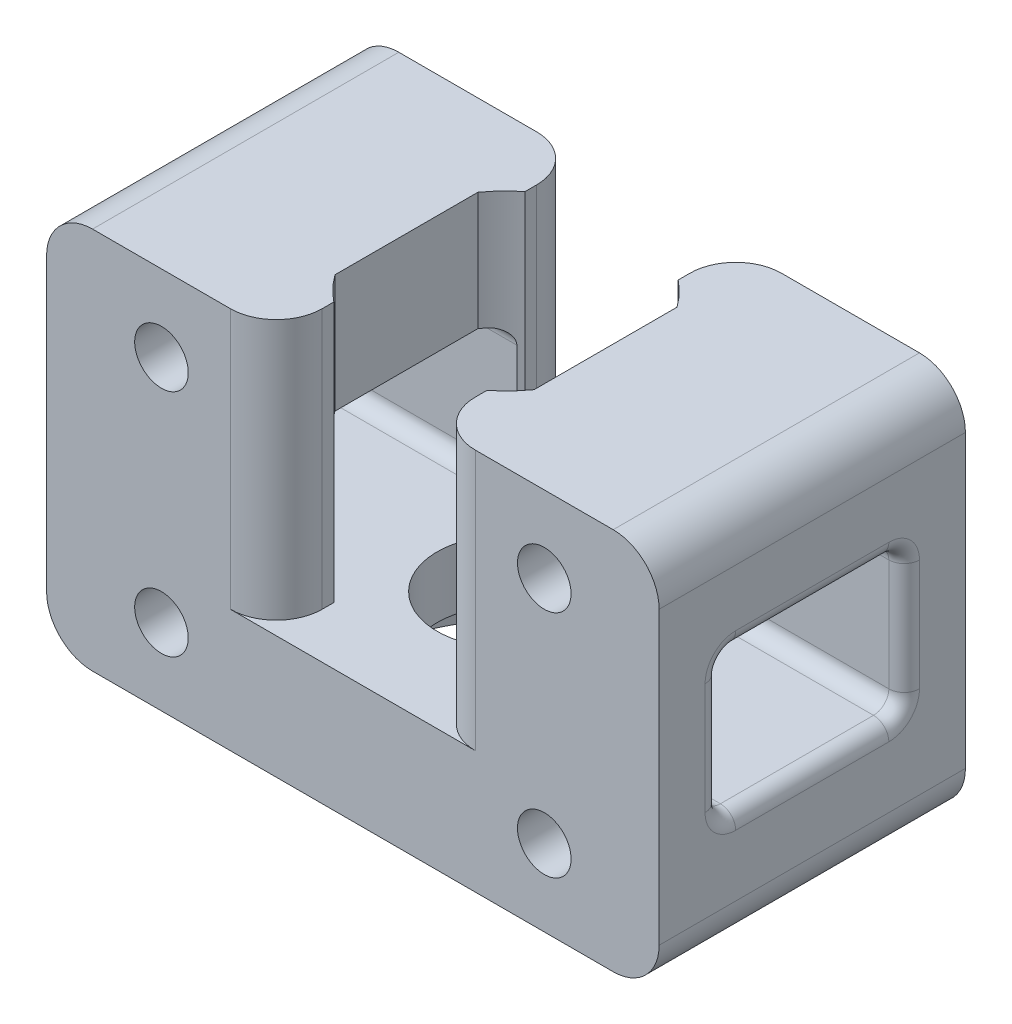
from build123d import *

# Parameters (mm, degrees)
SKETCH_1_W          = 40
SKETCH_1_H          = 25
EXTRUDE_1_DEPTH     = 20
SKETCH_2_R          = 4.5
CUT_EXTRUDE_1_DEPTH = 52.23475383
CUT_EXTRUDE_2_DEPTH = 17
SKETCH_4_R          = 1.75
SKETCH_4_W          = 10
SKETCH_4_H          = 17
CUT_EXTRUDE_3_DEPTH = 52.23475383
FILLET_1_R          = 3
SKETCH_5_R          = 9
CUT_EXTRUDE_4_DEPTH = 4
SKETCH_7_W          = 12
SKETCH_7_H          = 9.287727203
CUT_EXTRUDE_5_DEPTH = 52.23475383
FILLET_2_R          = 1


with BuildPart() as part:
    # 草图1 → 凸台-拉伸1 (new body)
    with BuildSketch(Plane.XY):
        with Locations((20, 12.5)):
            Rectangle(SKETCH_1_W, SKETCH_1_H)
    extrude(amount=EXTRUDE_1_DEPTH)

    # 草图2 → 切除-拉伸1 (cut, through all)
    with BuildSketch(Plane(origin=(0, 25, 0), x_dir=(1, 0, 0), z_dir=(0, 1, 0))):
        with Locations(Location((20, -10, 0), (0, 0, 270))):
            Circle(SKETCH_2_R)
    extrude(amount=-CUT_EXTRUDE_1_DEPTH, mode=Mode.SUBTRACT)

    # 草图3 → 切除-拉伸2 (cut)
    with BuildSketch(Plane(origin=(0, 25, 0), x_dir=(1, 0, 0), z_dir=(0, 1, 0))):
        with BuildLine():
            Line((15.336310473, -3.5), (24.663689527, -3.5))
            ThreePointArc((24.663689527, -3.5), (25.656854249, -4.343145751), (26.5, -5.336310473))
            Line((26.5, -5.336310473), (26.5, -14.663689527))
            ThreePointArc((26.5, -14.663689527), (25.656854249, -15.656854249), (24.663689527, -16.5))
            Line((24.663689527, -16.5), (15.336310473, -16.5))
            ThreePointArc((15.336310473, -16.5), (14.343145751, -15.656854249), (13.5, -14.663689527))
            Line((13.5, -14.663689527), (13.5, -5.336310473))
            ThreePointArc((13.5, -5.336310473), (14.343145751, -4.343145751), (15.336310473, -3.5))
        make_face()
    extrude(amount=-CUT_EXTRUDE_2_DEPTH, mode=Mode.SUBTRACT)

    # 草图4 → 切除-拉伸3 (cut, through all)
    with BuildSketch(Plane(origin=(0, 0, 0), x_dir=(-1, 0, 0), z_dir=(0, 0, -1))):
        with Locations((-32.5, 20)):
            Circle(SKETCH_4_R)
        with Locations((-32.5, 5)):
            Circle(SKETCH_4_R)
        with Locations((-7.5, 20)):
            Circle(SKETCH_4_R)
        with Locations((-7.5, 5)):
            Circle(SKETCH_4_R)
        with Locations((-20, 16.5)):
            Rectangle(SKETCH_4_W, SKETCH_4_H)
    extrude(amount=-CUT_EXTRUDE_3_DEPTH, mode=Mode.SUBTRACT)

    # 圆角1
    fillet_1_edges = [part.edges().sort_by_distance(p)[0] for p in [
        (25, 16.5, 20),
        (15, 16.5, 20),
        (25, 16.5, 0),
        (15, 16.5, 0),
        (0, 25, 10),
        (40, 25, 10),
        (40, 0, 10),
        (0, 0, 10),
    ]]
    fillet(fillet_1_edges, radius=FILLET_1_R)

    # 草图5 → 切除-拉伸4 (cut)
    with BuildSketch(Plane.XZ):
        with Locations(Location((20, 10, 0), (0, 0, 270))):
            Circle(SKETCH_5_R)
    extrude(amount=-CUT_EXTRUDE_4_DEPTH, mode=Mode.SUBTRACT)

    # 草图7 → 切除-拉伸5 (cut, through all)
    with BuildSketch(Plane(origin=(40, 0, 0), x_dir=(0, 0, -1), z_dir=(1, 0, 0))):
        with Locations((-10, 12.643863601)):
            Rectangle(SKETCH_7_W, SKETCH_7_H)
    extrude(amount=-CUT_EXTRUDE_5_DEPTH, mode=Mode.SUBTRACT)

    # 圆角2
    fillet_2_edges = [part.edges().sort_by_distance(p)[0] for p in [
        (7.354248689, 17.287727203, 4),
        (0, 12.643863602, 4),
        (32.645751311, 17.287727203, 4),
        (32.645751311, 8, 16),
        (7.354248689, 8, 16),
        (0, 12.643863602, 16),
        (32.645751311, 17.287727203, 16),
        (0, 17.287727203, 10),
        (7.354248689, 17.287727203, 16),
        (32.645751311, 8, 4),
        (7.354248689, 8, 4),
        (0, 8, 10),
        (40, 12.643863602, 16),
        (40, 8, 10),
        (40, 12.643863602, 4),
        (40, 17.287727203, 10),
    ]]
    fillet(fillet_2_edges, radius=FILLET_2_R)


solid = part.part
